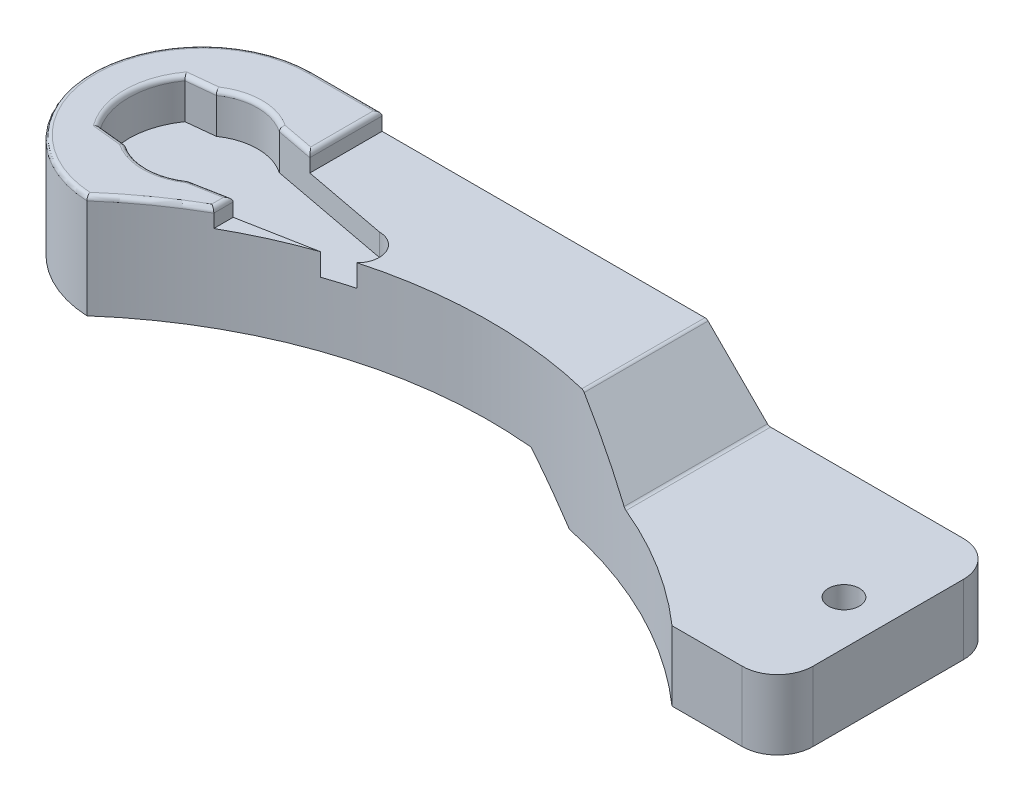
from build123d import *

# Parameters (mm, degrees)
SKETCH1_W                    = 90
SKETCH1_H                    = 25
BOSS_EXTRUDE1_DEPTH          = 16.87
CUT_EXTRUDE2_DEPTH           = 4.5
ENL_V_MAT_EXTRU_1_DEPTH      = 34
FILLET1_RADIUS               = 12.5
FILLET1_LENGTH               = 11.75
ESQUISSE5_R                  = 1.75
ENL_V_MAT_EXTRU_4_DEPTH      = 50.65729453
FILLET3_R                    = 4
SKETCH8_W                    = 38.029495875
SKETCH8_H                    = 20.943583685
CUT_EXTRUDE6_DEPTH           = 2
ESQUISSE17_R                 = 6.45
ENL_V_MAT_EXTRU_7_DEPTH      = 3.6
ENL_V_MAT_EXTRU_8_DEPTH      = 50.65729453
ENL_V_MAT_EXTRU_8_DEPTH_BACK = 50.65729453
ESQUISSE18_R                 = 50
FILLET4_R                    = 0.5


with BuildPart() as part:
    # Sketch1 → Boss-Extrude1 (new body)
    with BuildSketch(Plane(origin=(0, 0, 0), x_dir=(1, 0, 0), z_dir=(0, 1, 0))):
        Rectangle(SKETCH1_W, SKETCH1_H)
    extrude(amount=BOSS_EXTRUDE1_DEPTH)

    # Sketch3 → Cut-Extrude2 (cut)
    with BuildSketch(Plane(origin=(0, 16.87, 0), x_dir=(1, 0, 0), z_dir=(0, 1, 0))):
        with BuildLine():
            Line((-39.272085844, 4.798838748), (-36.060975614, 5.136336504))
            ThreePointArc((-36.060975614, 5.136336504), (-32.500000002, 6.25), (-28.93902439, 5.136336506))
            Line((-28.93902439, 5.136336506), (-15, 2.5))
            ThreePointArc((-15, 2.5), (-12.5, 0), (-15, -2.5))
            Line((-15, -2.5), (-28.93902439, -5.136336506))
            ThreePointArc((-28.93902439, -5.136336506), (-32.500000002, -6.25), (-36.060975614, -5.136336504))
            Line((-36.060975614, -5.136336504), (-39.272085844, -4.798838748))
            ThreePointArc((-39.272085844, -4.798838748), (-40.8, 0), (-39.272085844, 4.798838748))
        make_face()
    extrude(amount=-CUT_EXTRUDE2_DEPTH, mode=Mode.SUBTRACT)

    # Esquisse2 → Enlèv. mat.-Extru.1 (cut)
    with BuildSketch(Plane.XY.offset(12.5)):
        Polygon((45, 16.87), (10, 16.87), (19, 7.87), (45, 7.87), align=None)
        Polygon((-45, 0), (10, 0), (4.88, 5.12), (-45, 5.12), align=None)
    extrude(amount=-ENL_V_MAT_EXTRU_1_DEPTH, mode=Mode.SUBTRACT)

    # Fillet1: full round fillet: the end face becomes a half cylinder, R = half its width
    fillet1_face = Plane((-45, 10.995, 0), x_dir=(0, -1, 0), z_dir=(-1, 0, 0))  # on the end face: x along it, z out of the body
    fillet1_slab = fillet1_face.offset(-FILLET1_RADIUS / 2) * Box(FILLET1_LENGTH, 2 * FILLET1_RADIUS, FILLET1_RADIUS, mode=Mode.PRIVATE)  # the body's end, R deep
    fillet1_round = Plane((-32.5, 10.995, 0), x_dir=(-1, 0, 0), z_dir=(0, -1, 0)) * Cylinder(FILLET1_RADIUS, FILLET1_LENGTH, mode=Mode.PRIVATE)  # its axis R under the face
    add(fillet1_slab - fillet1_round, mode=Mode.SUBTRACT)

    # Esquisse5 → Enlèv. mat.-Extru.4 (cut, through all)
    with BuildSketch(Plane(origin=(0, 0, 0), x_dir=(-1, 0, 0), z_dir=(0, -1, 0))):
        with Locations(Location((-40, 0, 0), (0, 0, 90))):
            Circle(ESQUISSE5_R)
    extrude(amount=-ENL_V_MAT_EXTRU_4_DEPTH, mode=Mode.SUBTRACT)

    # Fillet3
    fillet3_edges = [part.edges().sort_by_distance(p)[0] for p in [
        (45, 3.935, -12.5),
        (45, 3.935, 12.5),
    ]]
    fillet(fillet3_edges, radius=FILLET3_R)

    # Sketch8 → Cut-Extrude6 (cut)
    with BuildSketch(Plane(origin=(0, 16.87, 0), x_dir=(1, 0, 0), z_dir=(0, 1, 0))):
        with Locations((-5.673362901, 3.675760168)):
            Rectangle(SKETCH8_W, SKETCH8_H)
    extrude(amount=-CUT_EXTRUDE6_DEPTH, mode=Mode.SUBTRACT)

    # Esquisse17 → Enlèv. mat.-Extru.7 (cut)
    with BuildSketch(Plane.XZ.offset(-5.12)):
        with Locations((-32.5, 0)):
            Circle(ESQUISSE17_R)
    extrude(amount=-ENL_V_MAT_EXTRU_7_DEPTH, mode=Mode.SUBTRACT)

    # Esquisse18 → Enlèv. mat.-Extru.8 (cut, two sides: drawn at the far end of the back side and taken through both)
    with BuildSketch(Plane(origin=(0, 0, 0), x_dir=(1, 0, 0), z_dir=(0, 1, 0)).offset(-ENL_V_MAT_EXTRU_8_DEPTH_BACK)):
        with Locations((0, -50)):
            Circle(ESQUISSE18_R)
    extrude(amount=ENL_V_MAT_EXTRU_8_DEPTH + ENL_V_MAT_EXTRU_8_DEPTH_BACK, mode=Mode.SUBTRACT)

    # Fillet4
    fillet4_edges = [part.edges().sort_by_distance(p)[0] for p in [
        (-28.594055419, 16.87, -12.5),
        (19, 7.87, -4.37466216),
        (12, 14.87, -5.519322199),
        (-37.666530729, 16.87, -4.967587626),
        (-26.813567614, 16.87, -4.734341422),
        (-32.500000002, 16.87, -6.25),
        (-37.666530729, 16.87, 4.967587626),
        (-24.688110839, 16.87, 5.426249162),
        (-26.813567614, 16.87, 4.734341422),
        (-32.500000002, 16.87, 6.25),
        (-40.8, 16.87, 0),
        (-24.688110839, 16.87, -8.416173168),
        (-29.026696429, 16.87, 9.288197111),
        (-44.996887004, 16.87, -0.278953754),
    ]]
    fillet(fillet4_edges, radius=FILLET4_R)


solid = part.part
